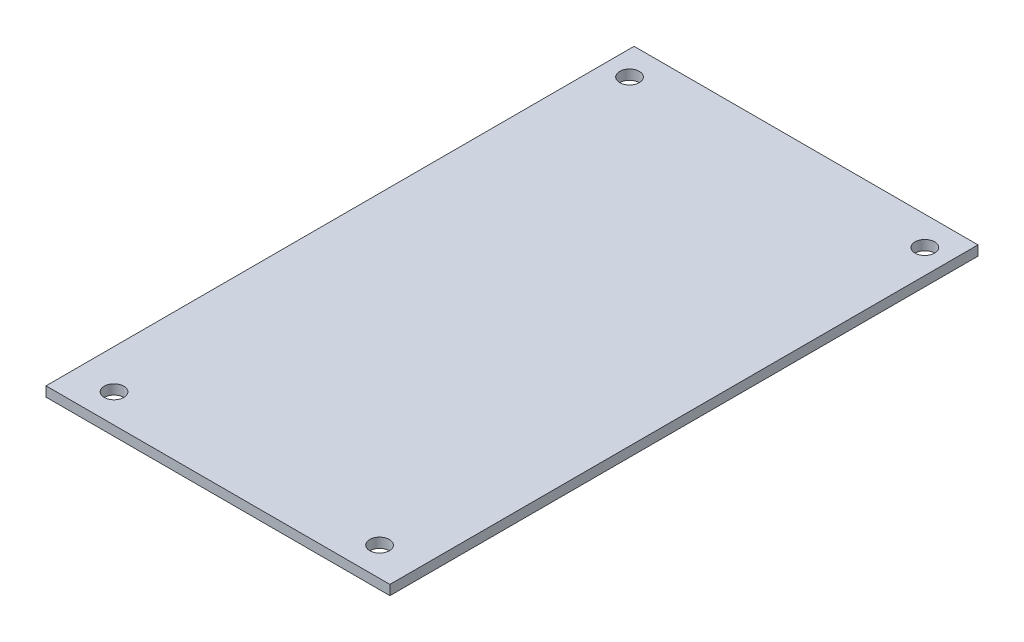
from build123d import *

# Parameters (mm, degrees)
SKETCH1_W           = 55.7022
SKETCH1_H           = 95.25
BOSS_EXTRUDE1_DEPTH = 1.5875
SKETCH2_R           = 1.5875
CUT_EXTRUDE1_DEPTH  = 111.353150119


with BuildPart() as part:
    # Sketch1 → Boss-Extrude1 (new body)
    with BuildSketch(Plane(origin=(0, 0, 0), x_dir=(1, 0, 0), z_dir=(0, 1, 0))):
        with Locations((27.8511, 47.625)):
            Rectangle(SKETCH1_W, SKETCH1_H)
    extrude(amount=BOSS_EXTRUDE1_DEPTH)

    # Sketch2 → Cut-Extrude1 (cut, through all)
    with BuildSketch(Plane(origin=(0, 1.5875, 0), x_dir=(1, 0, 0), z_dir=(0, 1, 0))):
        with Locations(Location((3.937, 90.5764, 0), (0, 0, 270))):
            Circle(SKETCH2_R)
        with Locations(Location((51.7652, 90.5764, 0), (0, 0, 270))):
            Circle(SKETCH2_R)
        with Locations(Location((6.35, 4.6736, 0), (0, 0, 270))):
            Circle(SKETCH2_R)
        with Locations(Location((49.3522, 4.6736, 0), (0, 0, 270))):
            Circle(SKETCH2_R)
    extrude(amount=-CUT_EXTRUDE1_DEPTH, mode=Mode.SUBTRACT)


solid = part.part
